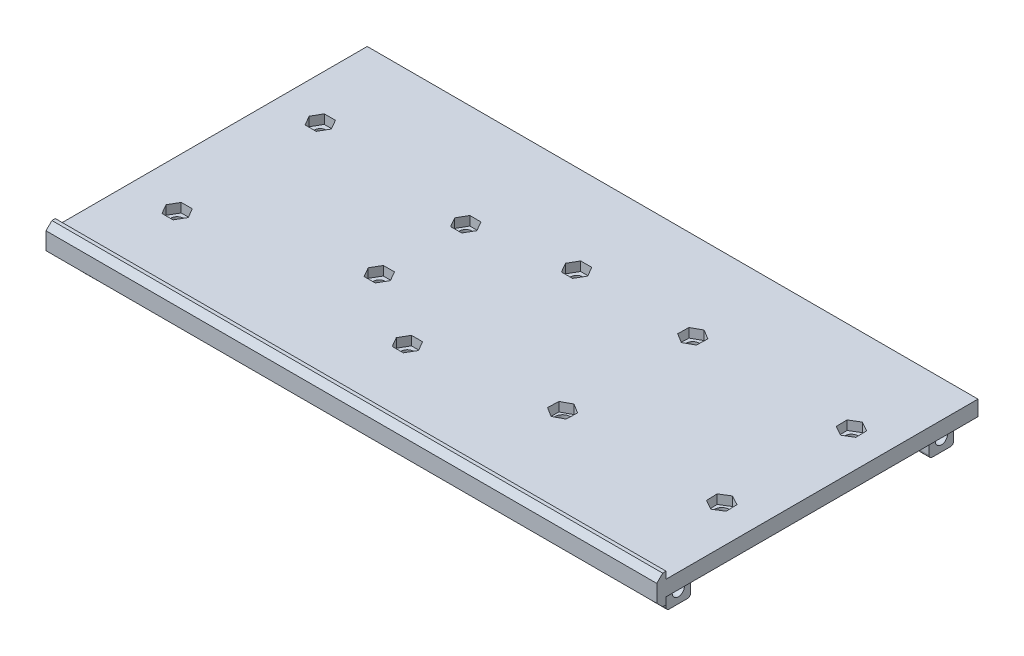
from build123d import *

# Parameters (mm, degrees)
CROQUIS3_W              = 200
CROQUIS3_H              = 100
CROQUIS3_R              = 2.45
CROQUIS3_R_2            = 2.450173308
SALIENTE_EXTRUIR1_DEPTH = 5
SALIENTE_EXTRUIR2_START = -9
CROQUIS4_R              = 3.372577113
CROQUIS4_R_2            = 1.872577113
CROQUIS4_R_3            = 3.527614965
CROQUIS4_R_4            = 2.027614965
CROQUIS4_R_5            = 3.462984948
CROQUIS4_R_6            = 1.962984948
CROQUIS4_R_7            = 3.478351446
CROQUIS4_R_8            = 1.978351446
CROQUIS4_R_9            = 3.459412365
CROQUIS4_R_10           = 1.959412365
CROQUIS4_R_11           = 3.625491316
CROQUIS4_R_12           = 2.125491316
CROQUIS4_R_13           = 4.450173308
CROQUIS4_R_14           = 2.450173308
CROQUIS4_R_15           = 4.124173106
CROQUIS4_R_16           = 2.124173106
CROQUIS4_R_17           = 4.031387243
CROQUIS4_R_18           = 2.031387243
CROQUIS4_R_19           = 4.264908663
CROQUIS4_R_20           = 2.264908663
SALIENTE_EXTRUIR2_DEPTH = 9
SALIENTE_EXTRUIR3_DEPTH = 200
CROQUIS9_W              = 5
CROQUIS9_H              = 8
SALIENTE_EXTRUIR4_DEPTH = 8
REDONDEO1_R             = 1
CROQUIS11_W             = 8
CROQUIS11_H             = 6
SALIENTE_EXTRUIR5_DEPTH = 8
REDONDEO3_R             = 2
CROQUIS13_R             = 2
CORTAR_EXTRUIR3_DEPTH   = 6
CORTAR_EXTRUIR4_START   = -6
CROQUIS14_R             = 2
CORTAR_EXTRUIR4_DEPTH   = 6
CROQUIS15_R             = 2
CORTAR_EXTRUIR5_DEPTH   = 6
CORTAR_EXTRUIR6_DEPTH   = 2.6
MATRIZL1_COUNT          = 2
MATRIZL1_PITCH          = 184.6
CORTAR_EXTRUIR7_DEPTH   = 2.6
MATRIZL2_COUNT          = 2
MATRIZL2_PITCH          = 100
CROQUIS25_R             = 1.872577113
CROQUIS25_R_2           = 2.125491316
CROQUIS25_R_3           = 1.959412365
CROQUIS25_R_4           = 1.978351446
CROQUIS25_R_5           = 1.962984948
CROQUIS25_R_6           = 2.027614965
CORTAR_EXTRUIR8_DEPTH   = 10
CORTAR_EXTRUIR9_START   = 2
CORTAR_EXTRUIR9_DEPTH   = 14
CHAFL_N1_SIZE           = 1


with BuildPart() as part:
    # Croquis3 → Saliente-Extruir1 (new body)
    with BuildSketch(Plane(origin=(0, 0, 0), x_dir=(1, 0, 0), z_dir=(0, 1, 0))):
        with Locations((-16.001013851, 0)):
            Rectangle(CROQUIS3_W, CROQUIS3_H)
        with Locations(Location((19.48962591, 21.100676249, 0), (0, 0, 270))):
            Circle(CROQUIS3_R, mode=Mode.SUBTRACT)
        with Locations(Location((71.658007858, 20.901971031, 0), (0, 0, 270))):
            Circle(CROQUIS3_R, mode=Mode.SUBTRACT)
        with Locations(Location((71.377578013, -21.310716777, 0), (0, 0, 270))):
            Circle(CROQUIS3_R, mode=Mode.SUBTRACT)
        with Locations(Location((19.142498915, -21.188320431, 0), (0, 0, 270))):
            Circle(CROQUIS3_R_2, mode=Mode.SUBTRACT)
    extrude(amount=SALIENTE_EXTRUIR1_DEPTH)

    # Croquis4 → Saliente-Extruir2 (add)
    # profile 1 of 10: a face of its own
    with BuildSketch(Plane(origin=(0, 5, 0), x_dir=(1, 0, 0), z_dir=(0, 1, 0)).offset(SALIENTE_EXTRUIR2_START)):
        with Locations(Location((-102.096455474, 20.709667607, 0), (0, 0, 270))):
            Circle(CROQUIS4_R)
        with Locations(Location((-102.096455474, 20.709667607, 0), (0, 0, 270))):
            Circle(CROQUIS4_R_2, mode=Mode.SUBTRACT)
    # profile 2 of 10: a face of its own
    with BuildSketch(Plane(origin=(0, 5, 0), x_dir=(1, 0, 0), z_dir=(0, 1, 0)).offset(SALIENTE_EXTRUIR2_START)):
        with Locations(Location((-100.424609792, -27.825911713, 0), (0, 0, 270))):
            Circle(CROQUIS4_R_3)
        with Locations(Location((-100.424609792, -27.825911713, 0), (0, 0, 270))):
            Circle(CROQUIS4_R_4, mode=Mode.SUBTRACT)
    # profile 3 of 10: a face of its own
    with BuildSketch(Plane(origin=(0, 5, 0), x_dir=(1, 0, 0), z_dir=(0, 1, 0)).offset(SALIENTE_EXTRUIR2_START)):
        with Locations(Location((-49.441800463, -12.612645778, 0), (0, 0, 270))):
            Circle(CROQUIS4_R_5)
        with Locations(Location((-49.441800463, -12.612645778, 0), (0, 0, 270))):
            Circle(CROQUIS4_R_6, mode=Mode.SUBTRACT)
    # profile 4 of 10: a face of its own
    with BuildSketch(Plane(origin=(0, 5, 0), x_dir=(1, 0, 0), z_dir=(0, 1, 0)).offset(SALIENTE_EXTRUIR2_START)):
        with Locations(Location((-25.022694884, -27.825911713, 0), (0, 0, 270))):
            Circle(CROQUIS4_R_7)
        with Locations(Location((-25.022694884, -27.825911713, 0), (0, 0, 270))):
            Circle(CROQUIS4_R_8, mode=Mode.SUBTRACT)
    # profile 5 of 10: a face of its own
    with BuildSketch(Plane(origin=(0, 5, 0), x_dir=(1, 0, 0), z_dir=(0, 1, 0)).offset(SALIENTE_EXTRUIR2_START)):
        with Locations(Location((-18.417307326, 20.979986322, 0), (0, 0, 270))):
            Circle(CROQUIS4_R_9)
        with Locations(Location((-18.417307326, 20.979986322, 0), (0, 0, 270))):
            Circle(CROQUIS4_R_10, mode=Mode.SUBTRACT)
    # profile 6 of 10: a face of its own
    with BuildSketch(Plane(origin=(0, 5, 0), x_dir=(1, 0, 0), z_dir=(0, 1, 0)).offset(SALIENTE_EXTRUIR2_START)):
        with Locations(Location((-49.441800463, 15.715109098, 0), (0, 0, 270))):
            Circle(CROQUIS4_R_11)
        with Locations(Location((-49.441800463, 15.715109098, 0), (0, 0, 270))):
            Circle(CROQUIS4_R_12, mode=Mode.SUBTRACT)
    # profile 7 of 10: a face of its own
    with BuildSketch(Plane(origin=(0, 5, 0), x_dir=(1, 0, 0), z_dir=(0, 1, 0)).offset(SALIENTE_EXTRUIR2_START)):
        with Locations(Location((19.142498915, -21.188320431, 0), (0, 0, 270))):
            Circle(CROQUIS4_R_13)
        with Locations(Location((19.142498915, -21.188320431, 0), (0, 0, 270))):
            Circle(CROQUIS4_R_14, mode=Mode.SUBTRACT)
    # profile 8 of 10: a face of its own
    with BuildSketch(Plane(origin=(0, 5, 0), x_dir=(1, 0, 0), z_dir=(0, 1, 0)).offset(SALIENTE_EXTRUIR2_START)):
        with Locations(Location((19.48962591, 21.100676249, 0), (0, 0, 270))):
            Circle(CROQUIS4_R_15)
        with Locations(Location((19.48962591, 21.100676249, 0), (0, 0, 270))):
            Circle(CROQUIS4_R_16, mode=Mode.SUBTRACT)
    # profile 9 of 10: a face of its own
    with BuildSketch(Plane(origin=(0, 5, 0), x_dir=(1, 0, 0), z_dir=(0, 1, 0)).offset(SALIENTE_EXTRUIR2_START)):
        with Locations(Location((71.658007858, 20.901971031, 0), (0, 0, 270))):
            Circle(CROQUIS4_R_17)
        with Locations(Location((71.658007858, 20.901971031, 0), (0, 0, 270))):
            Circle(CROQUIS4_R_18, mode=Mode.SUBTRACT)
    # profile 10 of 10: a face of its own
    with BuildSketch(Plane(origin=(0, 5, 0), x_dir=(1, 0, 0), z_dir=(0, 1, 0)).offset(SALIENTE_EXTRUIR2_START)):
        with Locations(Location((71.377578013, -21.310716777, 0), (0, 0, 270))):
            Circle(CROQUIS4_R_19)
        with Locations(Location((71.377578013, -21.310716777, 0), (0, 0, 270))):
            Circle(CROQUIS4_R_20, mode=Mode.SUBTRACT)
    extrude(amount=SALIENTE_EXTRUIR2_DEPTH)

    # Croquis8 → Saliente-Extruir3 (add)
    with BuildSketch(Plane(origin=(83.998986149, 0, 0), x_dir=(0, 0, -1), z_dir=(1, 0, 0))):
        Polygon((-50, 5), (-52.132961521, 5), (-52.132961521, 7.264269383), (-53.250029395, 7.264269383), (-55.186280375, 5.328018403), (-55.186280375, -0.328018403), (-53.250029395, -2.264269383), (-52.132961521, -2.264269383), (-52.132961521, 0), (-50, 0), align=None)
    extrude(amount=-SALIENTE_EXTRUIR3_DEPTH)

    # Croquis9 → Saliente-Extruir4 (add)
    with BuildSketch(Plane.XZ):
        with Locations((-109.501013851, 44.132961521)):
            Rectangle(CROQUIS9_W, CROQUIS9_H)
        with Locations((77.498986149, 44.132961521)):
            Rectangle(CROQUIS9_W, CROQUIS9_H)
        with Locations((77.498986149, -42)):
            Rectangle(CROQUIS9_W, CROQUIS9_H)
        with Locations((-109.501013851, -42)):
            Rectangle(CROQUIS9_W, CROQUIS9_H)
    extrude(amount=SALIENTE_EXTRUIR4_DEPTH)

    # Redondeo1
    redondeo1_edges = [part.edges().sort_by_distance(p)[0] for p in [
        (-109.501013851, -8, 40.132961521),
        (-109.501013851, -8, 48.132961521),
        (77.498986149, -8, 40.132961521),
        (77.498986149, -8, 48.132961521),
        (77.498986149, -8, -46),
        (77.498986149, -8, -38),
        (-109.501013851, -8, -46),
        (-109.501013851, -8, -38),
    ]]
    fillet(redondeo1_edges, radius=REDONDEO1_R)

    # Croquis11 → Saliente-Extruir5 (add)
    with BuildSketch(Plane.XZ):
        with Locations((-53.435930005, -43)):
            Rectangle(CROQUIS11_W, CROQUIS11_H)
        with Locations((46.564069995, -43)):
            Rectangle(CROQUIS11_W, CROQUIS11_H)
    extrude(amount=SALIENTE_EXTRUIR5_DEPTH)

    # Redondeo3
    redondeo3_edges = [part.edges().sort_by_distance(p)[0] for p in [
        (-57.435930005, -8, -43),
        (-49.435930005, -8, -43),
        (42.564069995, -8, -43),
        (50.564069995, -8, -43),
    ]]
    fillet(redondeo3_edges, radius=REDONDEO3_R)

    # Croquis13 → Cortar-Extruir3 (cut)
    with BuildSketch(Plane.ZY.offset(112.001013851)):
        with Locations((-42, -4)):
            Circle(CROQUIS13_R)
        with Locations((44.132961521, -4)):
            Circle(CROQUIS13_R)
    extrude(amount=-CORTAR_EXTRUIR3_DEPTH, mode=Mode.SUBTRACT)

    # Croquis14 → Cortar-Extruir4 (cut)
    with BuildSketch(Plane(origin=(79.998986149, 0, 0), x_dir=(0, 0, -1), z_dir=(1, 0, 0)).offset(CORTAR_EXTRUIR4_START)):
        with Locations(Location((-44.132961521, -4, 0), (0, 0, 180))):
            Circle(CROQUIS14_R)
        with Locations(Location((42, -4, 0), (0, 0, 180))):
            Circle(CROQUIS14_R)
    extrude(amount=CORTAR_EXTRUIR4_DEPTH, mode=Mode.SUBTRACT)

    # Croquis15 → Cortar-Extruir5 (cut)
    with BuildSketch(Plane(origin=(0, 0, -46), x_dir=(-1, 0, 0), z_dir=(0, 0, -1))):
        with Locations((-46.564069995, -4)):
            Circle(CROQUIS15_R)
        with Locations((53.435930005, -4)):
            Circle(CROQUIS15_R)
    extrude(amount=-CORTAR_EXTRUIR5_DEPTH, mode=Mode.SUBTRACT)

    # Croquis16 → Cortar-Extruir6 (cut)
    with BuildSketch(Plane(origin=(-107.001013851, 0, 0), x_dir=(0, 0, -1), z_dir=(1, 0, 0))):
        Polygon((38.976602349, -5.690877477), (41.952644025, -7.46377791), (44.976041676, -5.772900433), (45.023397651, -2.309122523), (42.047355975, -0.53622209), (39.023958324, -2.227099567), align=None)
        Polygon((-47.039621901, -5.88449607), (-43.954270242, -7.459489764), (-41.047609862, -5.574993694), (-41.226301141, -2.11550393), (-44.311652801, -0.540510236), (-47.218313181, -2.425006306), align=None)
    cortar_extruir6 = extrude(amount=-CORTAR_EXTRUIR6_DEPTH, mode=Mode.SUBTRACT)

    # MatrizL1: Cortar-Extruir6 ×2
    with Locations(*[(i * MATRIZL1_PITCH, 0, 0) for i in range(1, MATRIZL1_COUNT)]):
        add(cortar_extruir6, mode=Mode.SUBTRACT)

    # Croquis17 → Cortar-Extruir7 (cut)
    with BuildSketch(Plane.XY.offset(-40)):
        Polygon((49.555525945, -2.253234047), (46.54705428, -0.535940176), (43.555598329, -2.282706129), (43.572614044, -5.746765953), (46.58108571, -7.464059824), (49.57254166, -5.717293871), align=None)
    cortar_extruir7 = extrude(amount=-CORTAR_EXTRUIR7_DEPTH, mode=Mode.SUBTRACT)

    # MatrizL2: Cortar-Extruir7 ×2
    with Locations(*[(-i * MATRIZL2_PITCH, 0, 0) for i in range(1, MATRIZL2_COUNT)]):
        add(cortar_extruir7, mode=Mode.SUBTRACT)

    # Croquis25 → Cortar-Extruir8 (cut)
    with BuildSketch(Plane(origin=(0, 0, 0), x_dir=(1, 0, 0), z_dir=(0, 1, 0))):
        with Locations(Location((-102.096455474, 20.709667607, 0), (0, 0, 270))):
            Circle(CROQUIS25_R)
        with Locations(Location((-49.441800463, 15.715109098, 0), (0, 0, 270))):
            Circle(CROQUIS25_R_2)
        with Locations(Location((-18.417307326, 20.979986322, 0), (0, 0, 270))):
            Circle(CROQUIS25_R_3)
        with Locations(Location((-25.022694884, -27.825911713, 0), (0, 0, 270))):
            Circle(CROQUIS25_R_4)
        with Locations(Location((-49.441800463, -12.612645778, 0), (0, 0, 270))):
            Circle(CROQUIS25_R_5)
        with Locations(Location((-100.424609792, -27.825911713, 0), (0, 0, 270))):
            Circle(CROQUIS25_R_6)
    extrude(amount=CORTAR_EXTRUIR8_DEPTH, mode=Mode.SUBTRACT)

    # Croquis26 → Cortar-Extruir9 (cut)
    with BuildSketch(Plane(origin=(0, 0, 0), x_dir=(1, 0, 0), z_dir=(0, 1, 0)).offset(CORTAR_EXTRUIR9_START)):
        Polygon((-14.78000063, 20.979986322), (-16.598653978, 24.129986322), (-20.235960674, 24.129986322), (-22.054614022, 20.979986322), (-20.235960674, 17.829986322), (-16.598653978, 17.829986322), align=None)
        Polygon((-21.385388188, -27.825911713), (-23.204041536, -24.675911713), (-26.841348232, -24.675911713), (-28.66000158, -27.825911713), (-26.841348232, -30.975911713), (-23.204041536, -30.975911713), align=None)
        Polygon((-45.804493767, -12.612645778), (-47.623147115, -9.462645778), (-51.260453811, -9.462645778), (-53.079107159, -12.612645778), (-51.260453811, -15.762645778), (-47.623147115, -15.762645778), align=None)
        Polygon((-45.804493767, 15.715109098), (-47.623147115, 18.865109098), (-51.260453811, 18.865109098), (-53.079107159, 15.715109098), (-51.260453811, 12.565109098), (-47.623147115, 12.565109098), align=None)
        Polygon((-98.459148778, 20.709667607), (-100.277802126, 23.859667607), (-103.915108822, 23.859667607), (-105.73376217, 20.709667607), (-103.915108822, 17.559667607), (-100.277802126, 17.559667607), align=None)
        Polygon((-96.787303096, -27.825911713), (-98.605956444, -24.675911713), (-102.24326314, -24.675911713), (-104.061916488, -27.825911713), (-102.24326314, -30.975911713), (-98.605956444, -30.975911713), align=None)
        Polygon((22.68409848, 22.84002814), (19.580539271, 24.736846592), (16.386066701, 22.997494701), (16.29515334, 19.361324358), (19.398712549, 17.464505907), (22.593185118, 19.203857798), align=None)
        Polygon((74.768281649, 22.787759181), (71.58000431, 24.538441222), (68.469730519, 22.652653072), (68.547734067, 19.016182882), (71.736011406, 17.265500841), (74.846285197, 19.15128899), align=None)
        Polygon((74.466204821, -19.389679443), (71.258224284, -17.675368831), (68.169597476, -19.596406165), (68.288951205, -23.231754111), (71.496931742, -24.946064722), (74.58555855, -23.025027388), align=None)
        Polygon((22.350400487, -19.47386206), (19.261685198, -17.552966992), (16.053783626, -19.267425363), (15.934597343, -22.902778802), (19.023312632, -24.823673871), (22.231214204, -23.1092155), align=None)
    extrude(amount=CORTAR_EXTRUIR9_DEPTH, mode=Mode.SUBTRACT)

    # Chaflán1
    chafl_n1_edges = [part.edges().sort_by_distance(p)[0] for p in [
        (-49.441800463, -4, -19.340600414),
        (-102.096455474, -4, -24.08224472),
        (-100.424609792, -4, 24.298296748),
        (-49.441800463, -4, 9.14966083),
        (19.142498915, -4, 16.738147124),
        (19.48962591, -4, -25.224849355),
        (71.658007858, -4, -24.933358274),
        (71.377578013, -4, 17.045808113),
        (-25.022694884, -4, 24.347560266),
        (-18.417307326, -4, -24.439398687),
    ]]
    chamfer(chafl_n1_edges, length=CHAFL_N1_SIZE)


solid = part.part
